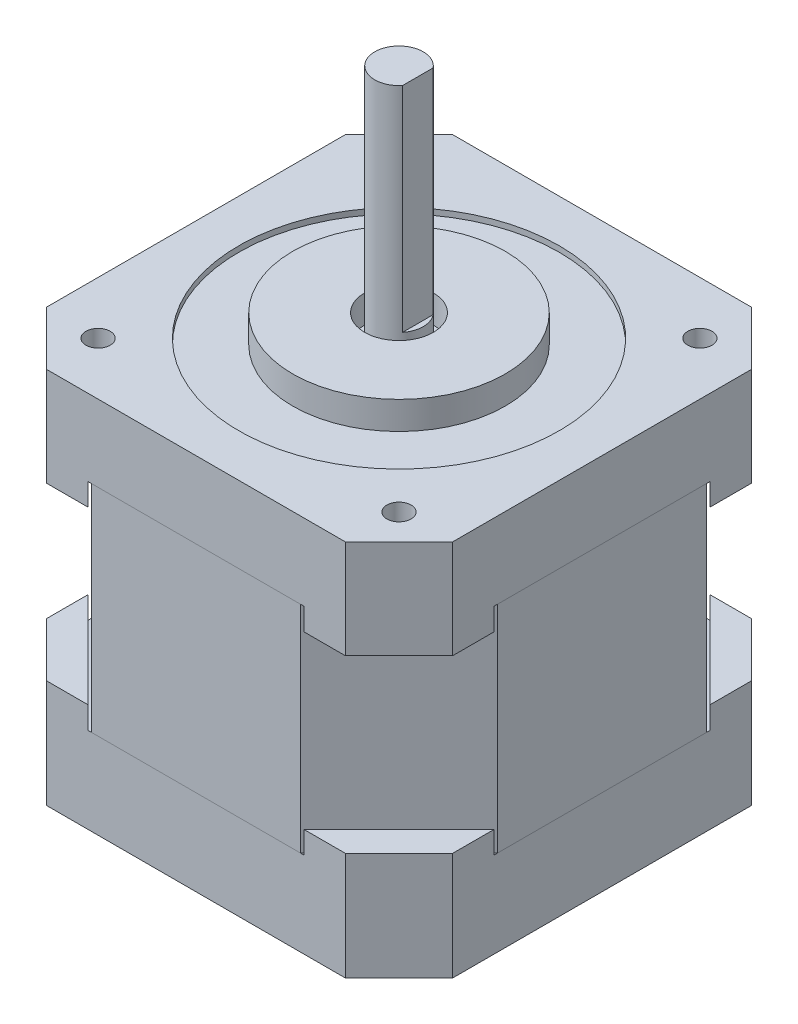
from build123d import *

# Parameters (mm, degrees)
SKETCH3_W           = 6.441091569
SKETCH3_H           = 9.606110701
CUT_EXTRUDE1_DEPTH  = 22.0218
SKETCH4_W           = 41.8592
SKETCH4_H           = 41.8592
SKETCH4_R           = 18.3896
BOSS_EXTRUDE1_DEPTH = 38.9128
CUT_EXTRUDE2_DEPTH  = 70.806450824
CIRPATTERN1_COUNT   = 4
SKETCH10_R          = 1.25
CUT_EXTRUDE3_DEPTH  = 4


with BuildPart() as part:
    # Sketch2 → Revolve1 (revolve)
    with BuildSketch(Plane.XY, mode=Mode.PRIVATE) as revolve1_sk:
        Polygon((0, 0), (0, 63.2206), (2.5, 63.2206), (2.5, 38.3286), (3.5306, 38.3286), (3.5306, 41.1988), (10.9474, 41.1988), (10.9474, 38.3286), (16.51, 38.3286), (16.51, 38.9128), (20.9296, 38.9128), (20.9296, 0), align=None)
    revolve(revolve1_sk.sketch.rotate(Axis((0, 0, 0), (0, 1, 0)), 90), axis=Axis((0, 0, 0), (0, 1, 0)))

    # Sketch3 → Cut-Extrude1 (cut)
    with BuildSketch(Plane(origin=(0, 63.2206, 0), x_dir=(1, 0, 0), z_dir=(0, 1, 0))):
        with Locations((5.165545785, 1.138296355)):
            Rectangle(SKETCH3_W, SKETCH3_H)
    extrude(amount=-CUT_EXTRUDE1_DEPTH, mode=Mode.SUBTRACT)

    # Sketch4 → Boss-Extrude1 (add)
    with BuildSketch(Plane(origin=(0, 0, 0), x_dir=(1, 0, 0), z_dir=(0, 1, 0))):
        Rectangle(SKETCH4_W, SKETCH4_H)
        Circle(SKETCH4_R, mode=Mode.SUBTRACT)
    extrude(amount=BOSS_EXTRUDE1_DEPTH)

    # Sketch5 → Cut-Extrude2 (cut, symmetric)
    with BuildSketch(Plane(origin=(0, 0, 0), x_dir=(0, 1, 0), z_dir=(0.7071067811865488, 0, 0.7071067811865464))):
        Polygon((0, 25.687324175), (11.1252, 25.687324175), (11.1252, 22.664724175), (8.8392, 22.664724175), (8.8392, 22.410724175), (11.1252, 22.410724175), (28.7528, 22.410724175), (31.0388, 22.410724175), (31.0388, 22.664724175), (28.7528, 22.664724175), (28.7528, 25.687324175), (38.9128, 25.687324175), (48.436079104, 25.687324175), (48.436079104, 38.399610954), (-11.393232354, 38.399610954), (-11.393232354, 25.687324175), align=None)
    cut_extrude2 = extrude(amount=CUT_EXTRUDE2_DEPTH, both=True, mode=Mode.SUBTRACT)

    # CirPattern1: Cut-Extrude2 ×4 about axis
    cirpattern1_axis = Axis((0, 0, 0), (0, 1, 0))
    for i in range(1, CIRPATTERN1_COUNT):
        add(cut_extrude2.rotate(cirpattern1_axis, i * 360 / CIRPATTERN1_COUNT), mode=Mode.SUBTRACT)

    # Sketch10 → Cut-Extrude3 (cut)
    with BuildSketch(Plane(origin=(0, 38.9128, 0), x_dir=(1, 0, 0), z_dir=(0, 1, 0))):
        with Locations(Location((-15.5, 15.5, 0), (0, 0, 270))):
            Circle(SKETCH10_R)
        with Locations(Location((15.5, 15.5, 0), (0, 0, 270))):
            Circle(SKETCH10_R)
        with Locations(Location((15.5, -15.5, 0), (0, 0, 270))):
            Circle(SKETCH10_R)
        with Locations(Location((-15.5, -15.5, 0), (0, 0, 270))):
            Circle(SKETCH10_R)
    extrude(amount=-CUT_EXTRUDE3_DEPTH, mode=Mode.SUBTRACT)


solid = part.part
